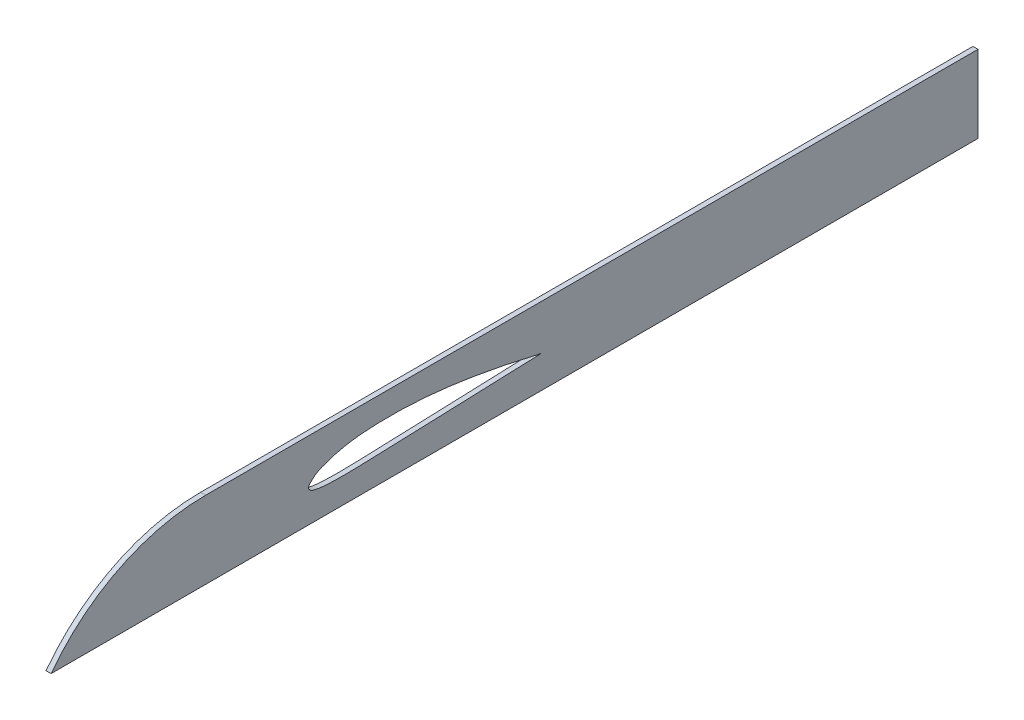
from build123d import *

# Parameters (mm, degrees)
BOSS_EXTRUDE1_DEPTH = 5
CUT_EXTRUDE3_DEPTH  = 5


with BuildPart() as part:
    # Fuselage Boundary → Boss-Extrude1 (new body)
    with BuildSketch(Plane(origin=(0, 0, 0), x_dir=(0, 0, -1), z_dir=(1, 0, 0))):
        with BuildLine():
            Line((0, 0), (914.4, 0))
            Line((914.4, 0), (914.4, 76.2))
            Line((914.4, 76.2), (152.4, 76.2))
            ThreePointArc((152.4, 76.2), (67.205810057, 56.088379885), (0, 0))
        make_face()
    extrude(amount=BOSS_EXTRUDE1_DEPTH)

    # Airfoil Cut → Cut-Extrude3 (cut)
    with BuildSketch(Plane(origin=(0, 0, 0), x_dir=(0, 0, -1), z_dir=(1, 0, 0))):
        with BuildLine():
            add(Edge.make_bspline(
                [(482.600154209, 31.75), (482.600170158, 31.796978748), (482.640283815, 32.644777132), (479.982523669, 32.187381534), (478.115665345, 33.027122129), (475.724301027, 33.507921736), (472.709352117, 34.227900598), (468.88661474, 35.106206723), (464.320717677, 36.140952261), (459.74847528, 37.151737345), (455.178081305, 38.140890665), (450.606469545, 39.103373123), (446.039163178, 40.056687552), (441.461498143, 40.93510486), (436.897391983, 41.852524621), (432.319547923, 42.682915245), (427.754836963, 43.553441008), (423.179856991, 44.345140973), (418.612251439, 45.141442019), (414.035460928, 45.859219493), (409.469689951, 46.615085), (404.895169699, 47.292899169), (400.326675804, 47.973337738), (395.752450023, 48.58270761), (391.185223072, 49.200750744), (386.609871363, 49.716192696), (382.038539278, 50.224484218), (377.469963886, 50.725362839), (372.895167583, 51.125073801), (368.324942709, 51.527058398), (363.753987997, 51.882818501), (359.18016564, 52.147089889), (354.609293692, 52.412567406), (350.037633691, 52.626976055), (345.465251819, 52.770227561), (340.892754848, 52.837812238), (336.320594826, 52.86766065), (331.748328873, 52.849725435), (327.176040481, 52.786311687), (322.603629892, 52.678248816), (318.031413585, 52.519911817), (313.457313582, 52.332945559), (308.884320845, 52.036027869), (304.309653752, 51.658658062), (299.734221484, 51.163534215), (295.15750937, 50.532624055), (290.581694173, 49.737716084), (286.009753882, 48.774157858), (281.428610585, 47.69031429), (276.843639871, 46.423488289), (272.271152065, 44.903046047), (268.448208924, 43.49689517), (265.410323967, 42.141487691), (263.112322774, 40.950414667), (260.786234986, 39.557056454), (258.638672859, 37.933369487), (257.015681401, 36.393085983), (255.801288583, 35.128295322), (255.014866713, 34.220095771), (254.495955139, 33.43937026), (254.247412687, 32.923041427), (254.087815391, 32.480511779), (253.939935662, 31.842690464), (254.003201841, 31.178039893), (254.25076304, 30.606332214), (254.487970184, 30.143552542), (255.000339131, 29.472075154), (255.764760468, 28.752962973), (256.966422477, 27.9352338), (258.67022048, 27.272739877), (260.846622408, 26.843510764), (263.129311349, 26.386410547), (265.417667326, 26.044194313), (268.464802746, 25.71020847), (272.278007626, 25.464082612), (276.851196766, 25.260545145), (281.423334985, 25.103041216), (285.996225618, 25.081527613), (290.568509129, 25.01879153), (295.140173232, 25.122224793), (299.713349873, 25.150842848), (304.284370598, 25.312619509), (308.857211382, 25.427937932), (313.428735407, 25.596010431), (318.001696311, 25.736619736), (322.572604869, 25.934407244), (327.146126883, 26.067948059), (331.717080676, 26.264353989), (336.289860661, 26.410488833), (340.862595864, 26.557859692), (345.433684021, 26.750557113), (350.006428007, 26.89768553), (354.579172855, 27.044790168), (359.150258427, 27.237558933), (363.723003106, 27.384668234), (368.295747769, 27.531778), (372.866833391, 27.724545368), (377.439578054, 27.871655132), (382.012322733, 28.018764443), (386.583408306, 28.211533169), (391.156153149, 28.358637954), (395.728897154, 28.50576582), (400.299985243, 28.698465297), (404.872720697, 28.845828485), (409.445499744, 28.99199196), (414.016457037, 29.188291025), (418.589965996, 29.322230633), (423.160923278, 29.518529707), (427.733702366, 29.664693146), (432.306437665, 29.81205647), (436.877526333, 30.004755438), (441.450268178, 30.151885204), (446.023021082, 30.298982897), (450.59407657, 30.491778096), (455.166933512, 30.638788622), (459.739259192, 30.786267067), (464.311908668, 30.977658331), (468.878817779, 31.129903055), (472.707491961, 31.236521198), (475.718239151, 31.389997839), (478.117040957, 31.381210406), (479.978948944, 31.833819302), (482.638670837, 30.868155021), (482.60013826, 31.703021252), (482.600154209, 31.75)],
                knots=[0, 0, 0, 0, 0.000293366, 0.00532164, 0.010338729, 0.015367004, 0.020384093, 0.030418271, 0.040441602, 0.050454315, 0.060456636, 0.070448794, 0.080431018, 0.090394064, 0.100357111, 0.110301904, 0.120246697, 0.130174167, 0.140093325, 0.149996564, 0.159899803, 0.169788063, 0.179669189, 0.189536757, 0.199397902, 0.209241213, 0.219079057, 0.228911676, 0.238730061, 0.248544183, 0.258350508, 0.268146955, 0.277940594, 0.287729351, 0.29751261, 0.307292571, 0.317071553, 0.326850536, 0.336630496, 0.346412412, 0.35619726, 0.365986016, 0.375785513, 0.385599636, 0.39543748, 0.405311708, 0.415239178, 0.425231336, 0.435287885, 0.445442844, 0.455740406, 0.466201502, 0.47156318, 0.477074156, 0.482801472, 0.488942721, 0.494304399, 0.497140269, 0.500195282, 0.501999078, 0.50313633, 0.503863196, 0.505014032, 0.507325031, 0.507960657, 0.509010462, 0.51065334, 0.513350958, 0.515710584, 0.519941848, 0.524958937, 0.529935839, 0.534879969, 0.539798891, 0.549601681, 0.559390437, 0.569173697, 0.578953046, 0.588732028, 0.598511989, 0.608291949, 0.618075209, 0.627858469, 0.637643317, 0.647428165, 0.657214845, 0.666999693, 0.676786373, 0.686571221, 0.696356069, 0.70614275, 0.715927598, 0.725712446, 0.735499126, 0.745283974, 0.755068822, 0.764855502, 0.77464035, 0.784425198, 0.794211878, 0.803996726, 0.813781574, 0.823568255, 0.833353103, 0.843137951, 0.852924631, 0.862709479, 0.872496159, 0.882281007, 0.892065855, 0.901852535, 0.911637383, 0.921422231, 0.931208912, 0.94099376, 0.950778608, 0.960565288, 0.970350136, 0.980134984, 0.985028324, 0.989921664, 0.994813294, 0.999706634, 1, 1, 1, 1], degree=3))
        make_face()
    extrude(amount=CUT_EXTRUDE3_DEPTH, mode=Mode.SUBTRACT)


solid = part.part
